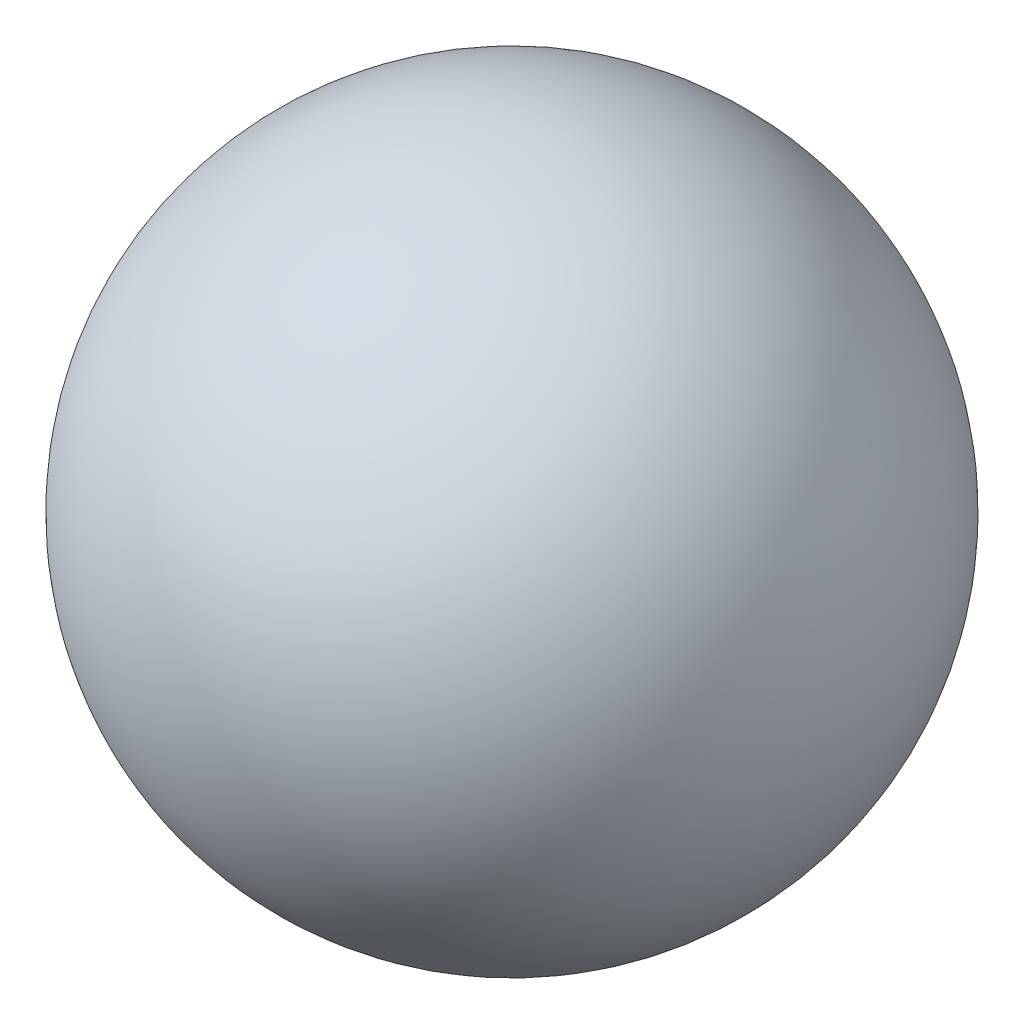
from build123d import *


with BuildPart() as part:
    # Sketch1 → Revolve1 (revolve)
    with BuildSketch(Plane(origin=(0, 0, 0), x_dir=(1, 0, 0), z_dir=(0, 1, 0))):
        with BuildLine():
            Line((0, 25.4), (0, -25.4))
            ThreePointArc((0, -25.4), (25.4, 0), (0, 25.4))
        make_face()
    revolve(axis=Axis((0, 0, -25.4), (0, 0, 1)))


solid = part.part
